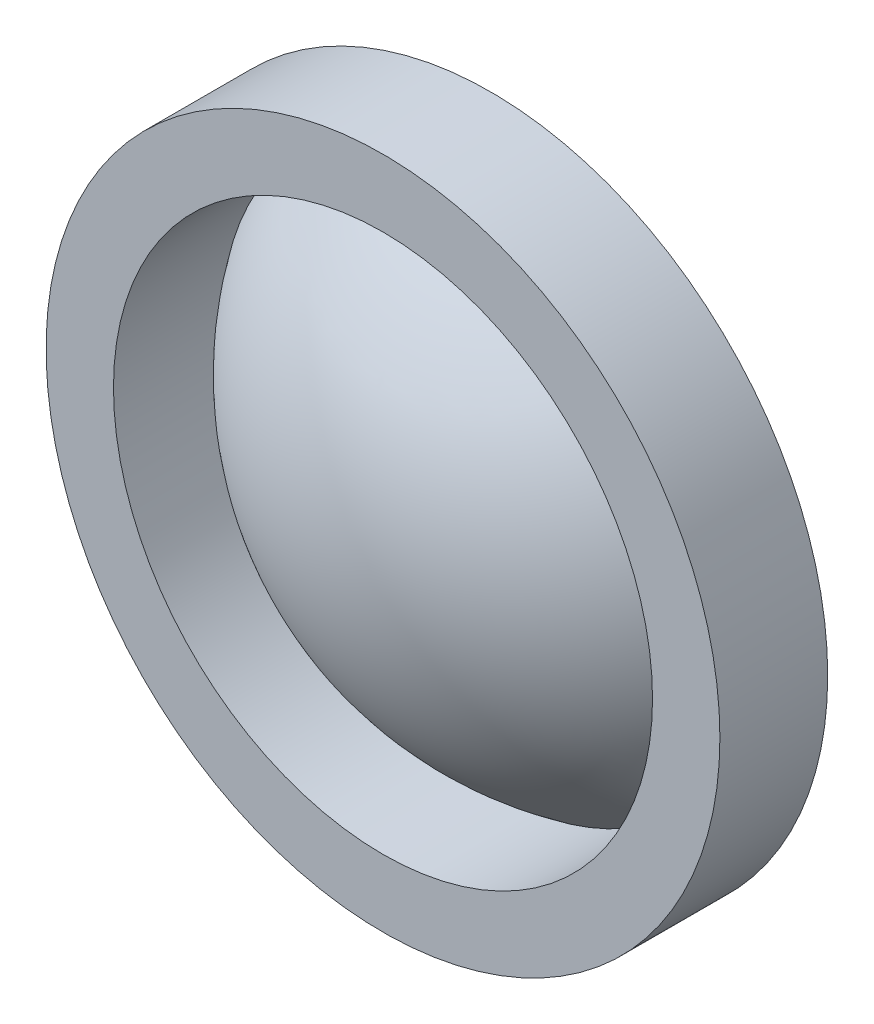
from build123d import *

# Parameters (mm, degrees)
SKETCH2_R           = 1250
SKETCH2_R_2         = 1000
BOSS_EXTRUDE1_DEPTH = 400


with BuildPart() as part:
    # Sketch2 → Boss-Extrude1 (new body)
    with BuildSketch(Plane.XY):
        Circle(SKETCH2_R)
        Circle(SKETCH2_R_2, mode=Mode.SUBTRACT)
    extrude(amount=BOSS_EXTRUDE1_DEPTH)


with BuildPart() as body_2:
    # Sketch3 → Revolve2 (revolve)
    with BuildSketch(Plane(origin=(0, 0, 0), x_dir=(0, 0, -1), z_dir=(1, 0, 0)), mode=Mode.PRIVATE) as revolve2_sk:
        with BuildLine():
            Line((0, 0), (0, -1000))
            ThreePointArc((0, -1000), (-388.426591115, -565.59211788), (-528.75114679, 0))
            Line((-528.75114679, 0), (0, 0))
        make_face()
    revolve(revolve2_sk.sketch.rotate(Axis((0, 0, 0), (0, 0, 1)), 180), axis=Axis((0, 0, 0), (0, 0, 1)))


solid = Compound([part.part, body_2.part])
